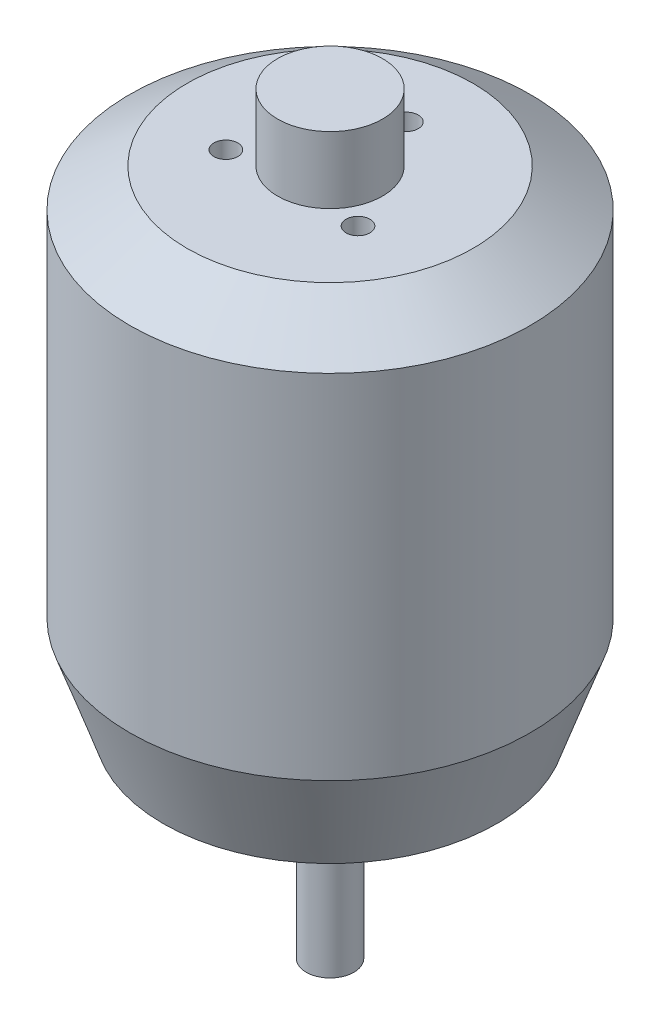
from build123d import *

# Parameters (mm, degrees)
SKETCH1_R           = 17.5
BOSS_EXTRUDE1_DEPTH = 10
SKETCH2_R           = 21
BOSS_EXTRUDE2_DEPTH = 37
SKETCH3_R           = 15
BOSS_EXTRUDE3_DEPTH = 4
SKETCH4_R           = 5.5
BOSS_EXTRUDE4_DEPTH = 7
SKETCH5_R           = 2.5
BOSS_EXTRUDE5_DEPTH = 21
SKETCH6_R           = 1.5
SKETCH6_R_2         = 4
CUT_EXTRUDE1_DEPTH  = 10
SKETCH7_R           = 5.25
BOSS_EXTRUDE6_DEPTH = 6.5
SKETCH9_R           = 1.25
CUT_EXTRUDE2_DEPTH  = 10


with BuildPart() as part:
    # Sketch1 → Boss-Extrude1 (new body)
    with BuildSketch(Plane(origin=(0, 0, 0), x_dir=(1, 0, 0), z_dir=(0, 1, 0))):
        with Locations(Location((0, 0, 0), (0, 0, 270))):
            Circle(SKETCH1_R)
    extrude(amount=BOSS_EXTRUDE1_DEPTH)

    # Sketch2 → Boss-Extrude2 (add)
    with BuildSketch(Plane(origin=(0, 10, 0), x_dir=(1, 0, 0), z_dir=(0, 1, 0))):
        with Locations(Location((0, 0, 0), (0, 0, 270))):
            Circle(SKETCH2_R)
    extrude(amount=BOSS_EXTRUDE2_DEPTH)

    # Sketch3 → Boss-Extrude3 (add)
    with BuildSketch(Plane(origin=(0, 47, 0), x_dir=(1, 0, 0), z_dir=(0, 1, 0))):
        with Locations(Location((0, 0, 0), (0, 0, 270))):
            Circle(SKETCH3_R)
    extrude(amount=BOSS_EXTRUDE3_DEPTH)

    # Sketch4 → Boss-Extrude4 (add)
    with BuildSketch(Plane(origin=(0, 51, 0), x_dir=(1, 0, 0), z_dir=(0, 1, 0))):
        with Locations(Location((0, 0, 0), (0, 0, 270))):
            Circle(SKETCH4_R)
    extrude(amount=BOSS_EXTRUDE4_DEPTH)

    # Sketch5 → Boss-Extrude5 (add)
    with BuildSketch(Plane.XZ):
        with Locations(Location((0, 0, 0), (0, 0, 90))):
            Circle(SKETCH5_R)
    extrude(amount=BOSS_EXTRUDE5_DEPTH)

    # loft up to a face of the part (loft1)
    loft([Face(Wire([part.edges().sort_by_distance((-12.75695098, 0, -11.979574354))[0]])), Face(Wire([part.edges().sort_by_distance((-15.308341176, 10, -14.375489225))[0]]))])

    # loft up to a face of the part (loft2)
    loft([Face(Wire([part.edges().sort_by_distance((10.934529411, 51, -10.268206589))[0]])), Face(Wire([part.edges().sort_by_distance((15.308341176, 47, -14.375489225))[0]]))])

    # Sketch6 → Cut-Extrude1 (cut)
    with BuildSketch(Plane.XZ):
        with Locations(Location((0, 12.5, 0), (0, 0, 270))):
            Circle(SKETCH6_R)
        with Locations(Location((12.5, 0, 0), (0, 0, 270))):
            Circle(SKETCH6_R)
        with Locations(Location((0, -12.5, 0), (0, 0, 270))):
            Circle(SKETCH6_R)
        with Locations(Location((-12.5, 0, 0), (0, 0, 270))):
            Circle(SKETCH6_R)
        with Locations(Location((-8.838834765, 8.838834765, 0), (0, 0, 270))):
            Circle(SKETCH6_R_2)
        with Locations(Location((8.838834765, 8.838834765, 0), (0, 0, 270))):
            Circle(SKETCH6_R_2)
        with Locations(Location((8.838834765, -8.838834765, 0), (0, 0, 270))):
            Circle(SKETCH6_R_2)
        with Locations(Location((-8.838834765, -8.838834765, 0), (0, 0, 270))):
            Circle(SKETCH6_R_2)
    extrude(amount=-CUT_EXTRUDE1_DEPTH, mode=Mode.SUBTRACT)

    # Sketch7 → Boss-Extrude6 (add)
    with BuildSketch(Plane.XZ):
        with Locations(Location((0, 0, 0), (0, 0, 90))):
            Circle(SKETCH7_R)
    extrude(amount=BOSS_EXTRUDE6_DEPTH)

    # Sketch9 → Cut-Extrude2 (cut)
    with BuildSketch(Plane(origin=(0, 51, 0), x_dir=(1, 0, 0), z_dir=(0, 1, 0))):
        with Locations(Location((0, 8, 0), (0, 0, 270))):
            Circle(SKETCH9_R)
        with Locations(Location((6.92820323, -4, 0), (0, 0, 270))):
            Circle(SKETCH9_R)
        with Locations(Location((-6.92820323, -4, 0), (0, 0, 270))):
            Circle(SKETCH9_R)
    extrude(amount=-CUT_EXTRUDE2_DEPTH, mode=Mode.SUBTRACT)


solid = part.part
